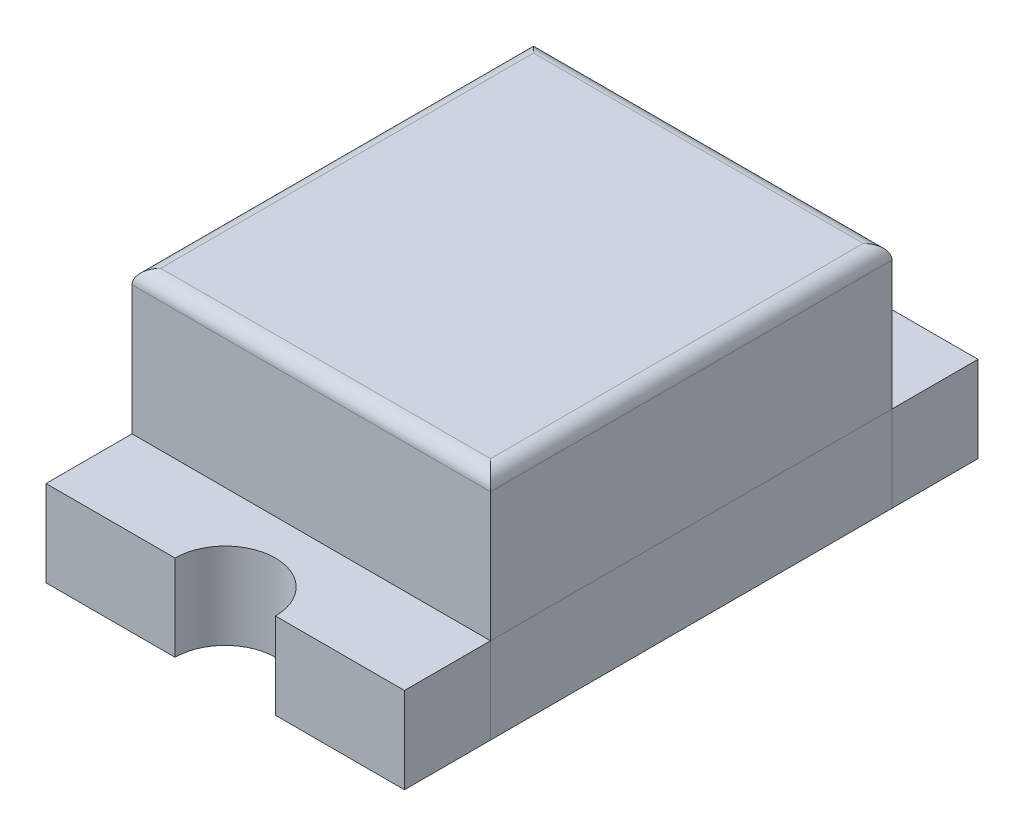
from build123d import *

# Parameters (mm, degrees)
SALIENTE_EXTRUIR1_DEPTH   = 0.3
SALIENTE_EXTRUIR1_2_DEPTH = 0.3
CROQUIS1_4_W              = 1.25
CROQUIS1_4_H              = 1.4
SALIENTE_EXTRUIR2_DEPTH   = 0.3
CROQUIS2_W                = 1.25
CROQUIS2_H                = 1.4
SALIENTE_EXTRUIR3_DEPTH   = 0.5
REDONDEO1_R               = 0.05
CROQUIS4_W                = 0.2
CROQUIS4_H                = 0.2
SALIENTE_EXTRUIR7_DEPTH   = 0.05


with BuildPart() as part:
    # Croquis1 → Saliente-Extruir1 (new body)
    with BuildSketch(Plane(origin=(0, 0, 0), x_dir=(1, 0, 0), z_dir=(0, 1, 0))):
        with BuildLine():
            Line((-0.625, 1), (-0.625, 0.7))
            Line((-0.625, 0.7), (0.625, 0.7))
            Line((0.625, 0.7), (0.625, 1))
            Line((0.625, 1), (0.175, 1))
            ThreePointArc((0.175, 1), (0, 0.825), (-0.175, 1))
            Line((-0.175, 1), (-0.625, 1))
        make_face()
    extrude(amount=SALIENTE_EXTRUIR1_DEPTH)


with BuildPart() as body_2:
    # Croquis1 → Saliente-Extruir1 2 (new body)
    with BuildSketch(Plane(origin=(0, 0, 0), x_dir=(1, 0, 0), z_dir=(0, 1, 0))):
        with BuildLine():
            Line((0.625, -0.7), (-0.625, -0.7))
            Line((-0.625, -0.7), (-0.625, -1))
            Line((-0.625, -1), (-0.175, -1))
            ThreePointArc((-0.175, -1), (0, -0.825), (0.175, -1))
            Line((0.175, -1), (0.625, -1))
            Line((0.625, -1), (0.625, -0.7))
        make_face()
    extrude(amount=SALIENTE_EXTRUIR1_2_DEPTH)


with BuildPart() as body_3:
    # Croquis1<4> → Saliente-Extruir2 (new body)
    with BuildSketch(Plane(origin=(0, 0, 0), x_dir=(1, 0, 0), z_dir=(0, 1, 0))):
        Rectangle(CROQUIS1_4_W, CROQUIS1_4_H)
    extrude(amount=SALIENTE_EXTRUIR2_DEPTH)


with BuildPart() as body_4:
    # Croquis2 → Saliente-Extruir3 (new body)
    with BuildSketch(Plane(origin=(0, 0.3, 0), x_dir=(1, 0, 0), z_dir=(0, 1, 0))):
        Rectangle(CROQUIS2_W, CROQUIS2_H)
    extrude(amount=SALIENTE_EXTRUIR3_DEPTH)

    # Redondeo1
    redondeo1_edges = [body_4.edges().sort_by_distance(p)[0] for p in [
        (-0.625, 0.8, 0),
        (0, 0.8, -0.7),
        (0.625, 0.8, 0),
        (0, 0.8, 0.7),
    ]]
    fillet(redondeo1_edges, radius=REDONDEO1_R)


with BuildPart() as body_5:
    # Croquis4 → Saliente-Extruir7 (new body)
    with BuildSketch(Plane(origin=(0, 0.3, 0), x_dir=(1, 0, 0), z_dir=(0, 1, 0))):
        with Locations((0, -0.1)):
            Rectangle(CROQUIS4_W, CROQUIS4_H)
    extrude(amount=SALIENTE_EXTRUIR7_DEPTH)


solid = Compound([part.part, body_2.part, body_3.part, body_4.part, body_5.part])
